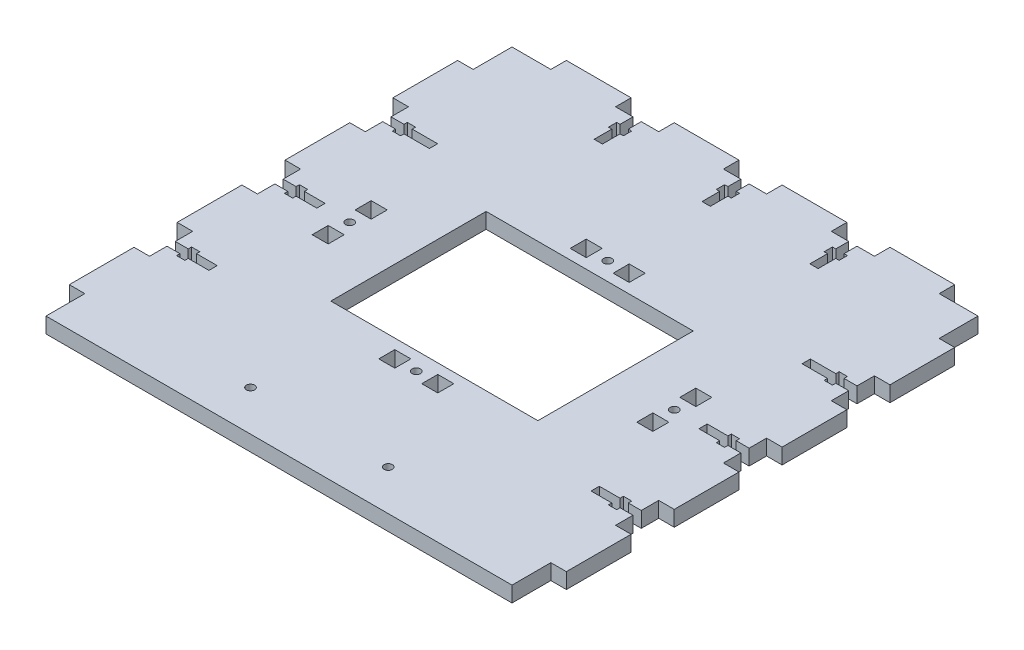
from build123d import *

# Parameters (mm, degrees)
SKETCH1_R           = 1.6
SKETCH1_W           = 6.2
SKETCH1_H           = 6.2
SKETCH1_W_2         = 80
SKETCH1_H_2         = 60
BOSS_EXTRUDE1_DEPTH = 6


with BuildPart() as part:
    # Sketch1 → Boss-Extrude1 (new body)
    with BuildSketch(Plane(origin=(0, 0, 0), x_dir=(1, 0, 0), z_dir=(0, 1, 0))):
        Polygon((85, 43.266666667), (90, 43.266666667), (90, 50), (96, 50), (96, 75), (90, 75), (90, 90), (75, 90), (75, 96), (50, 96), (50, 90), (43.266666667, 90), (43.266666667, 85), (44.566666667, 85), (44.566666667, 81.8), (43.266666667, 81.8), (43.266666667, 75), (40.066666667, 75), (40.066666667, 81.8), (38.766666667, 81.8), (38.766666667, 85), (40.066666667, 85), (40.066666667, 90), (33.333333333, 90), (33.333333333, 96), (8.333333333, 96), (8.333333333, 90), (1.6, 90), (1.6, 85), (2.9, 85), (2.9, 81.8), (1.6, 81.8), (1.6, 75), (-1.6, 75), (-1.6, 81.8), (-2.9, 81.8), (-2.9, 85), (-1.6, 85), (-1.6, 90), (-8.333333333, 90), (-8.333333333, 96), (-33.333333333, 96), (-33.333333333, 90), (-40.066666667, 90), (-40.066666667, 85), (-38.766666667, 85), (-38.766666667, 81.8), (-40.066666667, 81.8), (-40.066666667, 75), (-43.266666667, 75), (-43.266666667, 81.8), (-44.566666667, 81.8), (-44.566666667, 85), (-43.266666667, 85), (-43.266666667, 90), (-50, 90), (-50, 96), (-75, 96), (-75, 90), (-90, 90), (-90, 75), (-96, 75), (-96, 50), (-90, 50), (-90, 43.266666667), (-85, 43.266666667), (-85, 44.566666667), (-81.8, 44.566666667), (-81.8, 43.266666667), (-72, 43.266666667), (-72, 40.066666667), (-81.8, 40.066666667), (-81.8, 38.766666667), (-85, 38.766666667), (-85, 40.066666667), (-90, 40.066666667), (-90, 33.333333333), (-96, 33.333333333), (-96, 8.333333333), (-90, 8.333333333), (-90, 1.6), (-85, 1.6), (-85, 2.9), (-81.8, 2.9), (-81.8, 1.6), (-73.8, 1.6), (-73.8, -1.6), (-81.8, -1.6), (-81.8, -2.9), (-85, -2.9), (-85, -1.6), (-90, -1.6), (-90, -8.333333333), (-96, -8.333333333), (-96, -33.333333333), (-90, -33.333333333), (-90, -40.066666667), (-85, -40.066666667), (-85, -38.766666667), (-81.8, -38.766666667), (-81.8, -40.066666667), (-73.8, -40.066666667), (-73.8, -43.266666667), (-81.8, -43.266666667), (-81.8, -44.566666667), (-85, -44.566666667), (-85, -43.266666667), (-90, -43.266666667), (-90, -50), (-96, -50), (-96, -75), (-90, -75), (-90, -90), (90, -90), (90, -75), (96, -75), (96, -50), (90, -50), (90, -43.266666667), (85, -43.266666667), (85, -44.566666667), (81.8, -44.566666667), (81.8, -43.266666667), (73.8, -43.266666667), (73.8, -40.066666667), (81.8, -40.066666667), (81.8, -38.766666667), (85, -38.766666667), (85, -40.066666667), (90, -40.066666667), (90, -33.333333333), (96, -33.333333333), (96, -8.333333333), (90, -8.333333333), (90, -1.6), (85, -1.6), (85, -2.9), (81.8, -2.9), (81.8, -1.6), (73.8, -1.6), (73.8, 1.6), (81.8, 1.6), (81.8, 2.9), (85, 2.9), (85, 1.6), (90, 1.6), (90, 8.333333333), (96, 8.333333333), (96, 33.333333333), (90, 33.333333333), (90, 40.066666667), (85, 40.066666667), (85, 38.766666667), (81.8, 38.766666667), (81.8, 40.066666667), (72, 40.066666667), (72, 43.266666667), (81.8, 43.266666667), (81.8, 44.566666667), (85, 44.566666667), align=None)
        with Locations(Location((-26.6, -74.4, 0), (0, 0, 270))):
            Circle(SKETCH1_R, mode=Mode.SUBTRACT)
        with Locations((-62.7, -8.3)):
            Rectangle(SKETCH1_W, SKETCH1_H, mode=Mode.SUBTRACT)
        with Locations(Location((-62.7, 0, 0), (0, 0, 270))):
            Circle(SKETCH1_R, mode=Mode.SUBTRACT)
        with Locations((-8.3, -36.966666667)):
            Rectangle(SKETCH1_W, SKETCH1_H, mode=Mode.SUBTRACT)
        with Locations(Location((0, -36.966666667, 0), (0, 0, 270))):
            Circle(SKETCH1_R, mode=Mode.SUBTRACT)
        Rectangle(SKETCH1_W_2, SKETCH1_H_2, mode=Mode.SUBTRACT)
        with Locations(Location((26.6, -74.4, 0), (0, 0, 270))):
            Circle(SKETCH1_R, mode=Mode.SUBTRACT)
        with Locations((8.3, -36.966666667)):
            Rectangle(SKETCH1_W, SKETCH1_H, mode=Mode.SUBTRACT)
        with Locations((62.7, -8.3)):
            Rectangle(SKETCH1_W, SKETCH1_H, mode=Mode.SUBTRACT)
        with Locations(Location((62.7, 0, 0), (0, 0, 270))):
            Circle(SKETCH1_R, mode=Mode.SUBTRACT)
        with Locations((-62.7, 8.3)):
            Rectangle(SKETCH1_W, SKETCH1_H, mode=Mode.SUBTRACT)
        with Locations((-8.3, 36.966666667)):
            Rectangle(SKETCH1_W, SKETCH1_H, mode=Mode.SUBTRACT)
        with Locations(Location((0, 36.966666667, 0), (0, 0, 270))):
            Circle(SKETCH1_R, mode=Mode.SUBTRACT)
        with Locations((8.3, 36.966666667)):
            Rectangle(SKETCH1_W, SKETCH1_H, mode=Mode.SUBTRACT)
        with Locations((62.7, 8.3)):
            Rectangle(SKETCH1_W, SKETCH1_H, mode=Mode.SUBTRACT)
    extrude(amount=BOSS_EXTRUDE1_DEPTH)


solid = part.part
